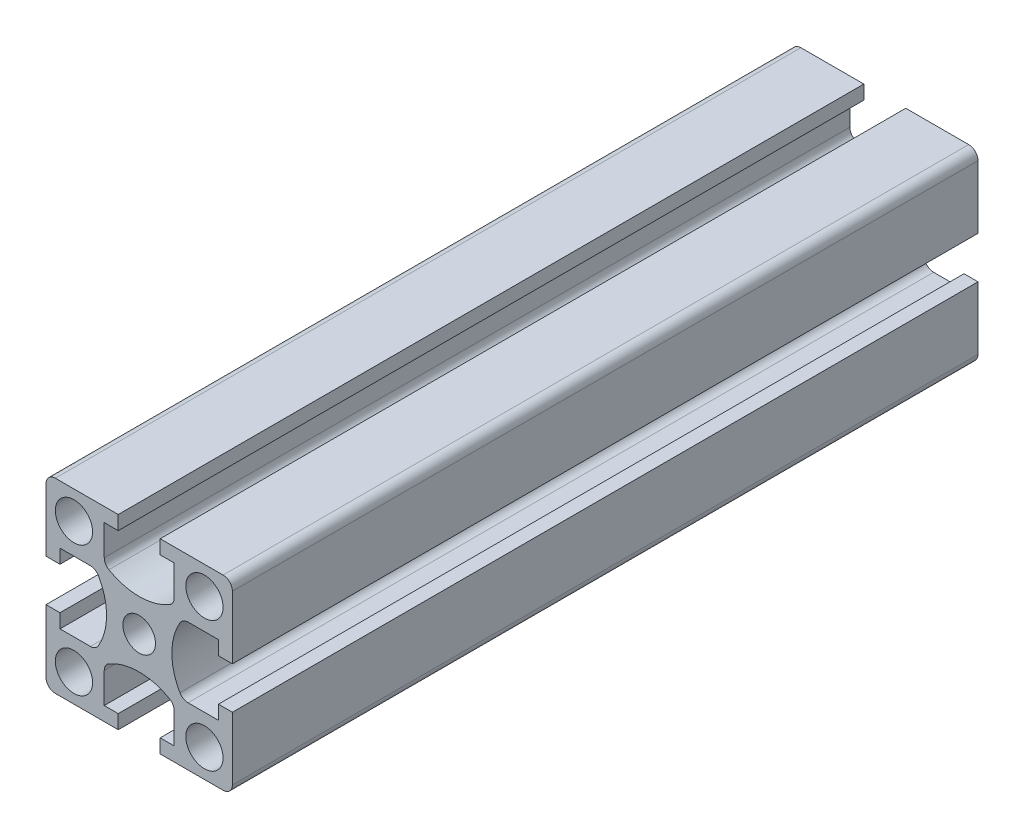
from build123d import *

# Parameters (mm, degrees)
SKETCH1_R           = 2.5
SKETCH1_R_2         = 2.1875
BOSS_EXTRUDE1_DEPTH = 100


with BuildPart() as part:
    # Sketch1 → Boss-Extrude1 (new body)
    with BuildSketch(Plane.XY):
        with BuildLine():
            Line((-12.5, 11.25), (-12.5, 2.8125))
            Line((-12.5, 2.8125), (-10.625, 2.8125))
            Line((-10.625, 2.8125), (-10.625, 4.6875))
            Line((-10.625, 4.6875), (-6.546075349, 4.6875))
            ThreePointArc((-6.546075349, 4.6875), (-5.921075349, 4.520031755), (-5.463543594, 4.0625))
            ThreePointArc((-5.463543594, 4.0625), (-4.375, 0), (-5.463543594, -4.0625))
            ThreePointArc((-5.463543594, -4.0625), (-5.921075349, -4.520031755), (-6.546075349, -4.6875))
            Line((-6.546075349, -4.6875), (-10.625, -4.6875))
            Line((-10.625, -4.6875), (-10.625, -2.8125))
            Line((-10.625, -2.8125), (-12.5, -2.8125))
            Line((-12.5, -2.8125), (-12.5, -11.25))
            ThreePointArc((-12.5, -11.25), (-12.133883476, -12.133883476), (-11.25, -12.5))
            Line((-11.25, -12.5), (-2.8125, -12.5))
            Line((-2.8125, -12.5), (-2.8125, -10.625))
            Line((-2.8125, -10.625), (-4.6875, -10.625))
            Line((-4.6875, -10.625), (-4.6875, -6.546075349))
            ThreePointArc((-4.6875, -6.546075349), (-4.520031755, -5.921075349), (-4.0625, -5.463543594))
            ThreePointArc((-4.0625, -5.463543594), (0, -4.375), (4.0625, -5.463543594))
            ThreePointArc((4.0625, -5.463543594), (4.520031755, -5.921075349), (4.6875, -6.546075349))
            Line((4.6875, -6.546075349), (4.6875, -10.625))
            Line((4.6875, -10.625), (2.8125, -10.625))
            Line((2.8125, -10.625), (2.8125, -12.5))
            Line((2.8125, -12.5), (11.25, -12.5))
            ThreePointArc((11.25, -12.5), (12.133883476, -12.133883476), (12.5, -11.25))
            Line((12.5, -11.25), (12.5, -2.8125))
            Line((12.5, -2.8125), (10.625, -2.8125))
            Line((10.625, -2.8125), (10.625, -4.6875))
            Line((10.625, -4.6875), (6.546075349, -4.6875))
            ThreePointArc((6.546075349, -4.6875), (5.921075349, -4.520031755), (5.463543594, -4.0625))
            ThreePointArc((5.463543594, -4.0625), (4.375, 0), (5.463543594, 4.0625))
            ThreePointArc((5.463543594, 4.0625), (5.921075349, 4.520031755), (6.546075349, 4.6875))
            Line((6.546075349, 4.6875), (10.625, 4.6875))
            Line((10.625, 4.6875), (10.625, 2.8125))
            Line((10.625, 2.8125), (12.5, 2.8125))
            Line((12.5, 2.8125), (12.5, 11.25))
            ThreePointArc((12.5, 11.25), (12.133883476, 12.133883476), (11.25, 12.5))
            Line((11.25, 12.5), (2.8125, 12.5))
            Line((2.8125, 12.5), (2.8125, 10.625))
            Line((2.8125, 10.625), (4.6875, 10.625))
            Line((4.6875, 10.625), (4.6875, 6.546075349))
            ThreePointArc((4.6875, 6.546075349), (4.520031755, 5.921075349), (4.0625, 5.463543594))
            ThreePointArc((4.0625, 5.463543594), (0, 4.375), (-4.0625, 5.463543594))
            ThreePointArc((-4.0625, 5.463543594), (-4.520031755, 5.921075349), (-4.6875, 6.546075349))
            Line((-4.6875, 6.546075349), (-4.6875, 10.625))
            Line((-4.6875, 10.625), (-2.8125, 10.625))
            Line((-2.8125, 10.625), (-2.8125, 12.5))
            Line((-2.8125, 12.5), (-11.25, 12.5))
            ThreePointArc((-11.25, 12.5), (-12.133883476, 12.133883476), (-12.5, 11.25))
        make_face()
        with Locations((-8.75, -8.75)):
            Circle(SKETCH1_R, mode=Mode.SUBTRACT)
        with Locations((8.75, -8.75)):
            Circle(SKETCH1_R, mode=Mode.SUBTRACT)
        with Locations((8.75, 8.75)):
            Circle(SKETCH1_R, mode=Mode.SUBTRACT)
        Circle(SKETCH1_R_2, mode=Mode.SUBTRACT)
        with Locations((-8.75, 8.75)):
            Circle(SKETCH1_R, mode=Mode.SUBTRACT)
    extrude(amount=BOSS_EXTRUDE1_DEPTH)


solid = part.part
